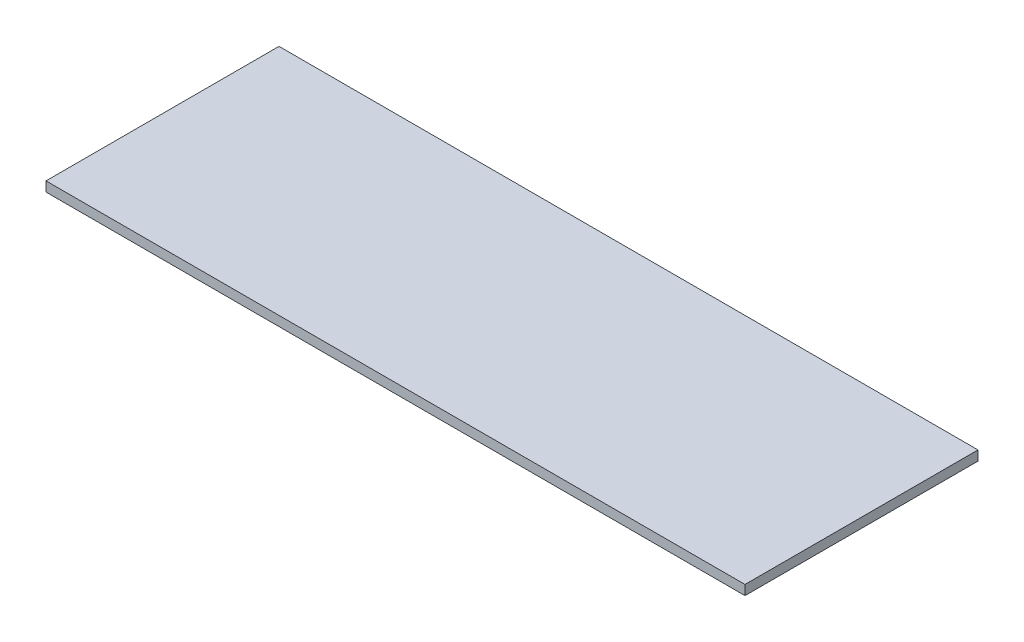
from build123d import *

# Parameters (mm, degrees)
SKETCH1_W           = 228.6
SKETCH1_H           = 76.2
BOSS_EXTRUDE1_DEPTH = 3.175


with BuildPart() as part:
    # Sketch1 → Boss-Extrude1 (new body)
    with BuildSketch(Plane(origin=(0, 0, 0), x_dir=(1, 0, 0), z_dir=(0, 1, 0))):
        Rectangle(SKETCH1_W, SKETCH1_H)
    extrude(amount=BOSS_EXTRUDE1_DEPTH)


solid = part.part
